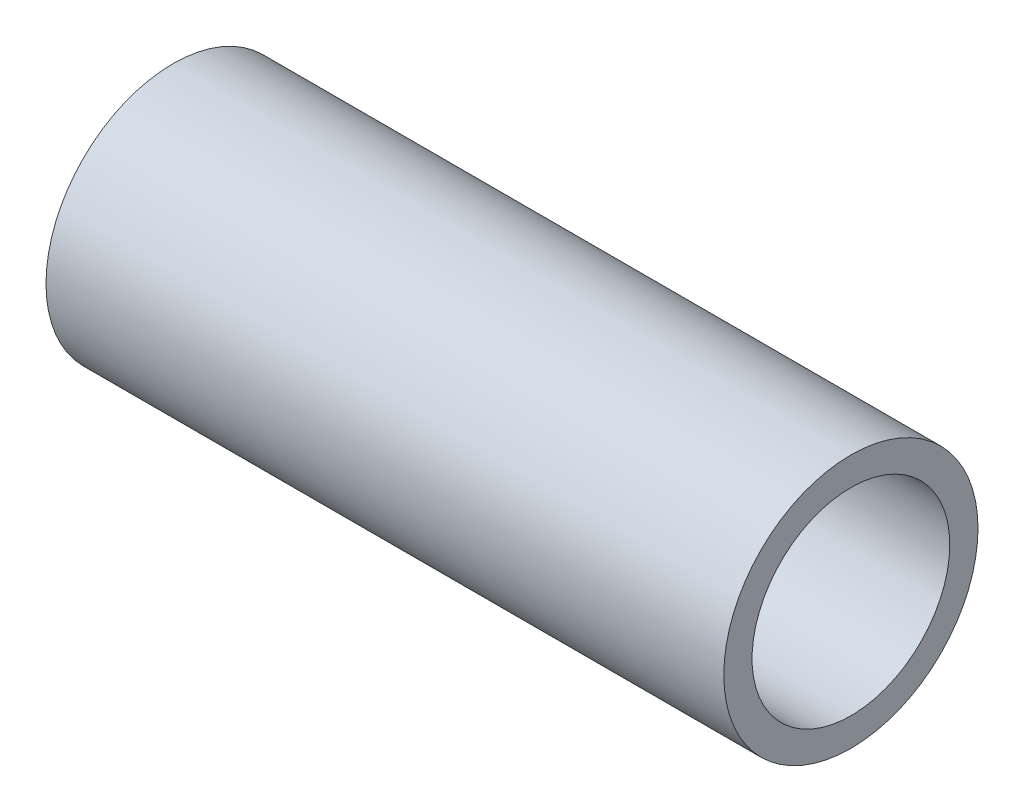
from build123d import *

# Parameters (mm, degrees)
SKETCH1_R           = 36
SKETCH1_R_2         = 28
BOSS_EXTRUDE1_DEPTH = 96


with BuildPart() as part:
    # Sketch1 → Boss-Extrude1 (new, symmetric)
    with BuildSketch(Plane(origin=(0, 0, 0), x_dir=(0, 0, -1), z_dir=(1, 0, 0))):
        Circle(SKETCH1_R)
        Circle(SKETCH1_R_2, mode=Mode.SUBTRACT)
    extrude(amount=BOSS_EXTRUDE1_DEPTH, both=True)


solid = part.part
